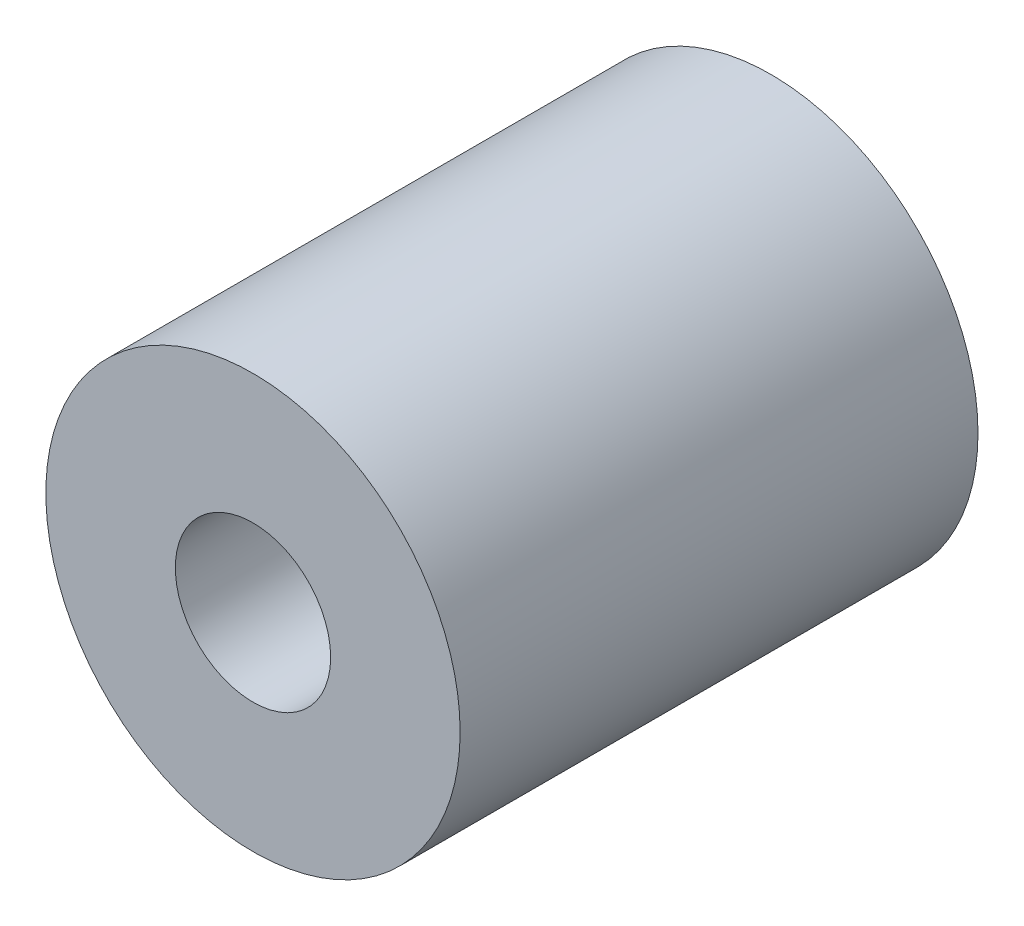
from build123d import *

# Parameters (mm, degrees)
SKETCH_1_R      = 4
SKETCH_1_R_2    = 1.5
EXTRUDE_1_DEPTH = 10


with BuildPart() as part:
    # 草图1 → 凸台-拉伸1 (new body)
    with BuildSketch(Plane.XY):
        Circle(SKETCH_1_R)
        Circle(SKETCH_1_R_2, mode=Mode.SUBTRACT)
    extrude(amount=EXTRUDE_1_DEPTH)


solid = part.part
